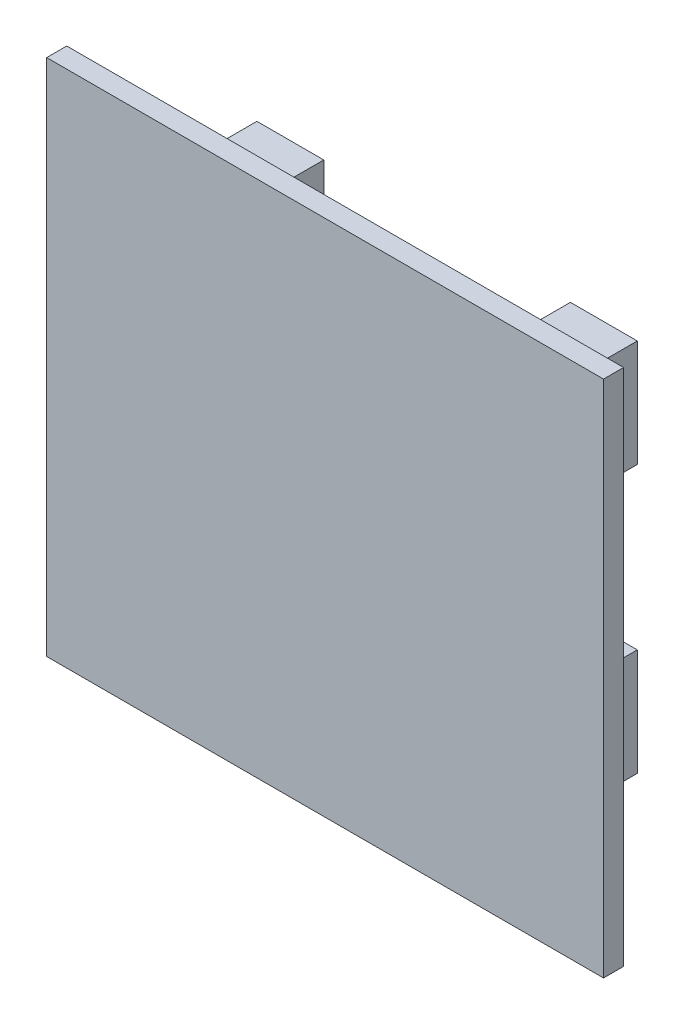
from build123d import *

# Parameters (mm, degrees)
SKETCH1_W           = 416.3
SKETCH1_H           = 387.782
BOSS_EXTRUDE1_DEPTH = 7.5
SKETCH3_W           = 50
SKETCH3_H           = 80
BOSS_EXTRUDE2_DEPTH = 76.2
SKETCH5_R           = 15.5
CUT_EXTRUDE1_DEPTH  = 410.077660574
SKETCH6_R           = 15.5
CUT_EXTRUDE2_DEPTH  = 315.576433289


with BuildPart() as part:
    # Sketch1 → Boss-Extrude1 (new, symmetric)
    with BuildSketch(Plane.XY):
        Rectangle(SKETCH1_W, SKETCH1_H)
    extrude(amount=BOSS_EXTRUDE1_DEPTH, both=True)

    # Sketch3 → Boss-Extrude2 (add)
    with BuildSketch(Plane(origin=(0, 0, -7.5), x_dir=(-1, 0, 0), z_dir=(0, 0, -1))):
        with Locations((117.2, 100)):
            Rectangle(SKETCH3_W, SKETCH3_H)
        with Locations((117.2, -100)):
            Rectangle(SKETCH3_W, SKETCH3_H)
        with Locations((-117.2, -100)):
            Rectangle(SKETCH3_W, SKETCH3_H)
        with Locations((-117.2, 100)):
            Rectangle(SKETCH3_W, SKETCH3_H)
        Rectangle(SKETCH3_W, SKETCH3_H)
    extrude(amount=BOSS_EXTRUDE2_DEPTH)

    # Sketch5 → Cut-Extrude1 (cut, through all)
    with BuildSketch(Plane.ZY.offset(142.2)):
        with Locations(Location((-45.6, 100, 0), (0, 0, 270))):
            Circle(SKETCH5_R)
        with Locations(Location((-45.6, -100, 0), (0, 0, 270))):
            Circle(SKETCH5_R)
    extrude(amount=-CUT_EXTRUDE1_DEPTH, mode=Mode.SUBTRACT)

    # Sketch6 → Cut-Extrude2 (cut, through all)
    with BuildSketch(Plane(origin=(25, 0, 0), x_dir=(0, 0, -1), z_dir=(1, 0, 0))):
        with Locations(Location((45.6, 0, 0), (0, 0, 90))):
            Circle(SKETCH6_R)
    extrude(amount=-CUT_EXTRUDE2_DEPTH, mode=Mode.SUBTRACT)


solid = part.part
